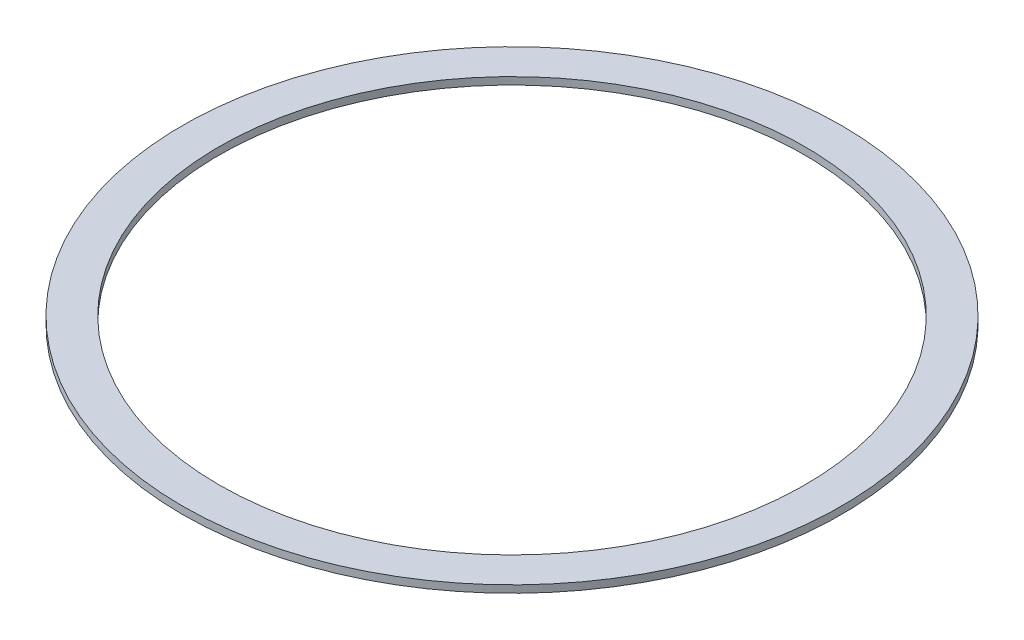
from build123d import *

# Parameters (mm, degrees)
SKETCH_1_R      = 22.5
SKETCH_1_R_2    = 20
EXTRUDE_1_DEPTH = 0.5


with BuildPart() as part:
    # 草图1 → 凸台-拉伸1 (new body)
    with BuildSketch(Plane(origin=(0, 0, 0), x_dir=(1, 0, 0), z_dir=(0, 1, 0))):
        with Locations(Location((0, 0, 0), (0, 0, 270))):
            Circle(SKETCH_1_R)
        with Locations(Location((0, 0, 0), (0, 0, 270))):
            Circle(SKETCH_1_R_2, mode=Mode.SUBTRACT)
    extrude(amount=EXTRUDE_1_DEPTH)


solid = part.part
